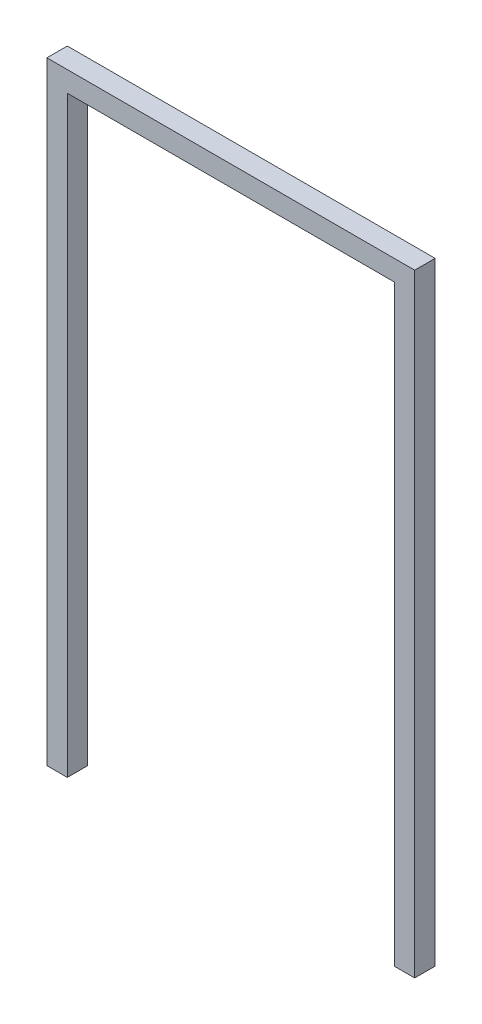
from build123d import *

# Parameters (mm, degrees)
BOSS_EXTRUDE1_DEPTH = 10


with BuildPart() as part:
    # Sketch2 → Boss-Extrude1 (new, symmetric)
    with BuildSketch(Plane.XY):
        Polygon((-180, 340), (180, 340), (180, -260), (160, -260), (160, 320), (-160, 320), (-160, -260), (-180, -260), align=None)
    extrude(amount=BOSS_EXTRUDE1_DEPTH, both=True)


solid = part.part
